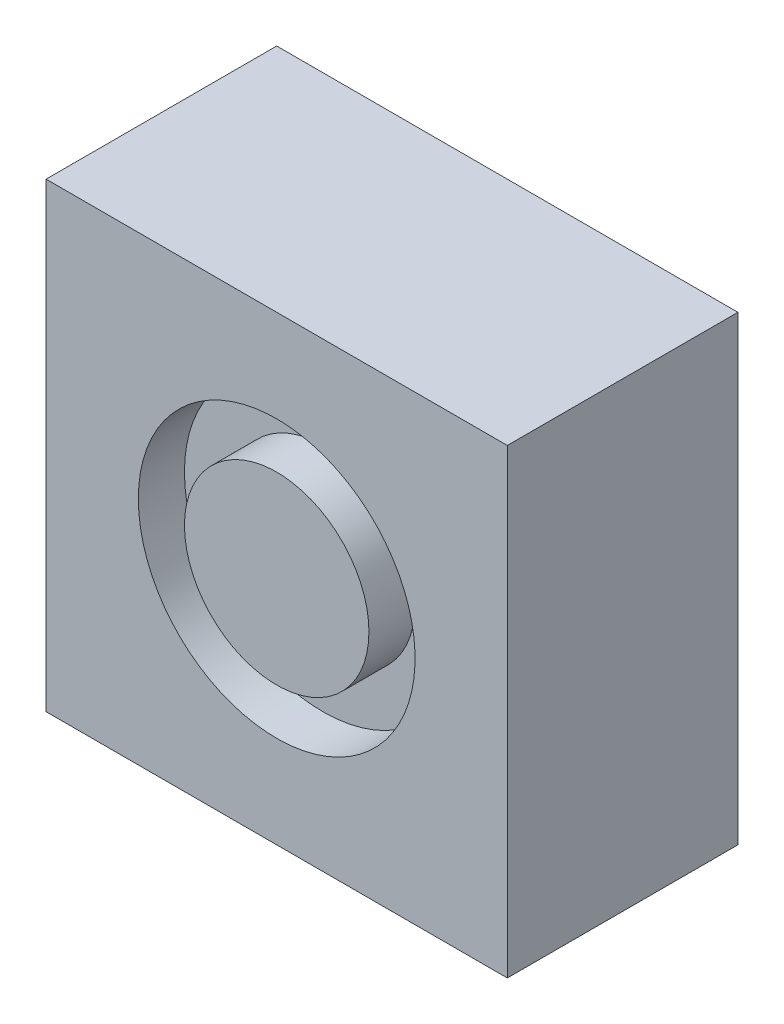
from build123d import *

# Parameters (mm, degrees)
SKIZZE1_W                       = 100
SKIZZE1_H                       = 100
AUFSATZ_LINEAR_AUSTRAGEN1_DEPTH = 50
SKIZZE5_W                       = 10
SKIZZE5_H                       = 20


with BuildPart() as part:
    # Skizze1 → Aufsatz-Linear austragen1 (new body)
    with BuildSketch(Plane.XY):
        Rectangle(SKIZZE1_W, SKIZZE1_H)
    extrude(amount=AUFSATZ_LINEAR_AUSTRAGEN1_DEPTH)

    # Schnitt-Austragung1: sweep along a path in Skizze2
    with BuildLine(Plane.XY.offset(50)) as schnitt_austragung1_path:
        CenterArc((0, 0), 25, 0, 360)
    # Skizze5 → Schnitt-Austragung1 (sweep, cut)
    with BuildSketch(Plane(origin=(0, 0, 0), x_dir=(1, 0, 0), z_dir=(0, 1, 0))):
        with Locations((-25, -50)):
            Rectangle(SKIZZE5_W, SKIZZE5_H)
    sweep(path=schnitt_austragung1_path.line, mode=Mode.SUBTRACT)


solid = part.part
